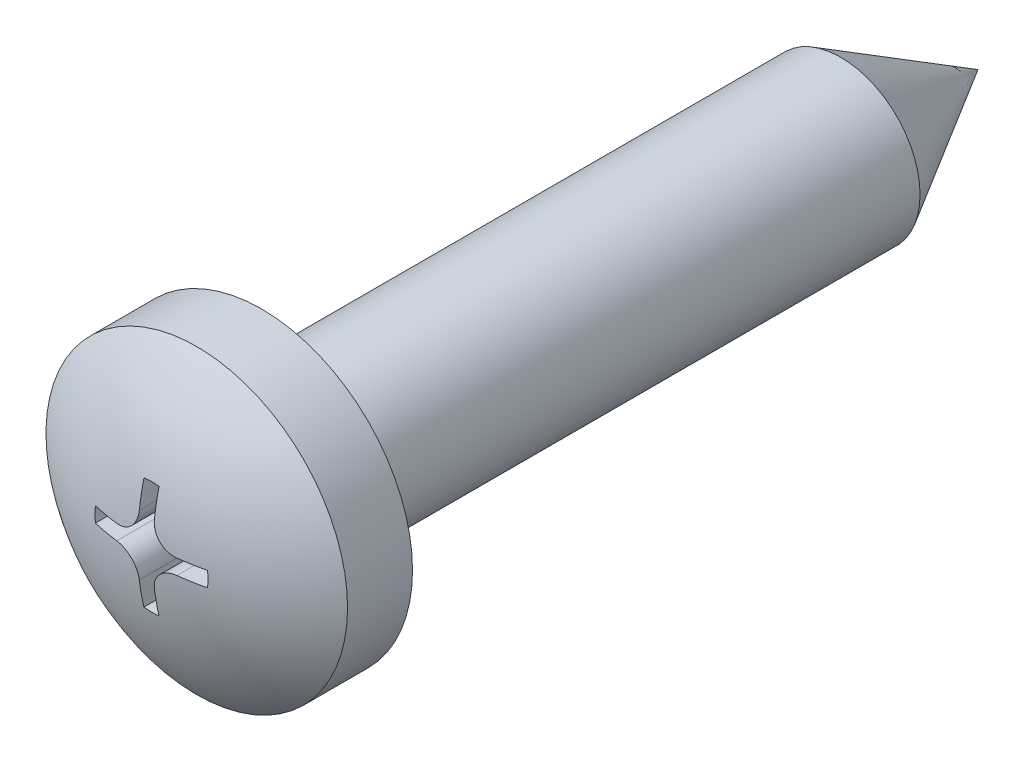
from build123d import *

# Parameters (mm, degrees)
CUT_EXTRUDE_2_DEPTH = 1.8
FILLET_1_R          = 0.2


with BuildPart() as part:
    # 草图8 → Revolve 1380 (revolve)
    with BuildSketch(Plane(origin=(0, 0, 0), x_dir=(0, 0, -1), z_dir=(1, 0, 0)), mode=Mode.PRIVATE) as revolve_1380_sk:
        with BuildLine():
            Line((0, 0), (-22.1, 0))
            ThreePointArc((-22.1, 0), (-21.746242348, 2.115113473), (-20.723475383, 4))
            Line((-20.723475383, 4), (-19, 4))
            Line((-19, 4), (-19, 2.1))
            Line((-19, 2.1), (-3.637306696, 2.1))
            Line((-3.637306696, 2.1), (0, 0))
        make_face()
    revolve(revolve_1380_sk.sketch.rotate(Axis((0, 0, 11.71), (0, 0, -1)), 90), axis=Axis((0, 0, 11.71), (0, 0, -1)))

    # 草图7 → 切除-拉伸2 (cut)
    with BuildSketch(Plane.XY.offset(22.1)):
        with BuildLine():
            Line((0.2, 1.486606875), (0.2, 0.797500009))
            ThreePointArc((0.2, 0.797500009), (0.375003701, 0.375003701), (0.797500009, 0.2))
            Line((0.797500009, 0.2), (1.486606875, 0.2))
            ThreePointArc((1.486606875, 0.2), (1.5, 0), (1.486606875, -0.2))
            Line((1.486606875, -0.2), (0.797500009, -0.2))
            ThreePointArc((0.797500009, -0.2), (0.375003701, -0.375003701), (0.2, -0.797500009))
            Line((0.2, -0.797500009), (0.2, -1.486606875))
            ThreePointArc((0.2, -1.486606875), (0, -1.5), (-0.2, -1.486606875))
            Line((-0.2, -1.486606875), (-0.2, -0.797500009))
            ThreePointArc((-0.2, -0.797500009), (-0.375003701, -0.375003701), (-0.797500009, -0.2))
            Line((-0.797500009, -0.2), (-1.486606875, -0.2))
            ThreePointArc((-1.486606875, -0.2), (-1.5, 0), (-1.486606875, 0.2))
            Line((-1.486606875, 0.2), (-0.797500009, 0.2))
            ThreePointArc((-0.797500009, 0.2), (-0.375003701, 0.375003701), (-0.2, 0.797500009))
            Line((-0.2, 0.797500009), (-0.2, 1.486606875))
            ThreePointArc((-0.2, 1.486606875), (0, 1.5), (0.2, 1.486606875))
        make_face()
    extrude(amount=-CUT_EXTRUDE_2_DEPTH, mode=Mode.SUBTRACT)

    # 圆角1
    fillet_1_edges = [part.edges().sort_by_distance(p)[0] for p in [
        (-2.1, 0, 19),
    ]]
    fillet(fillet_1_edges, radius=FILLET_1_R)


solid = part.part
